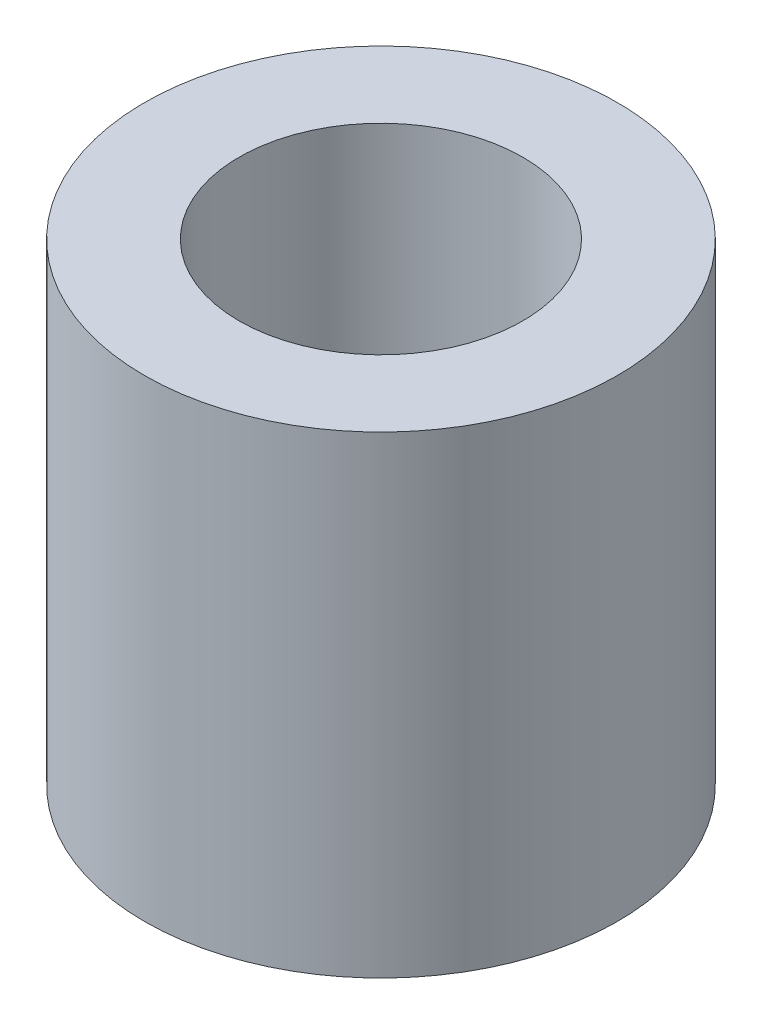
from build123d import *

# Parameters (mm, degrees)
SKETCH1_R           = 2.5
SKETCH1_R_2         = 1.5
BOSS_EXTRUDE2_DEPTH = 5


with BuildPart() as part:
    # Sketch1 → Boss-Extrude2 (new body)
    with BuildSketch(Plane(origin=(0, 0, 0), x_dir=(1, 0, 0), z_dir=(0, 1, 0))):
        with Locations(Location((0, 0, 0), (0, 0, 270))):
            Circle(SKETCH1_R)
        with Locations(Location((0, 0, 0), (0, 0, 270))):
            Circle(SKETCH1_R_2, mode=Mode.SUBTRACT)
    extrude(amount=BOSS_EXTRUDE2_DEPTH)


solid = part.part
